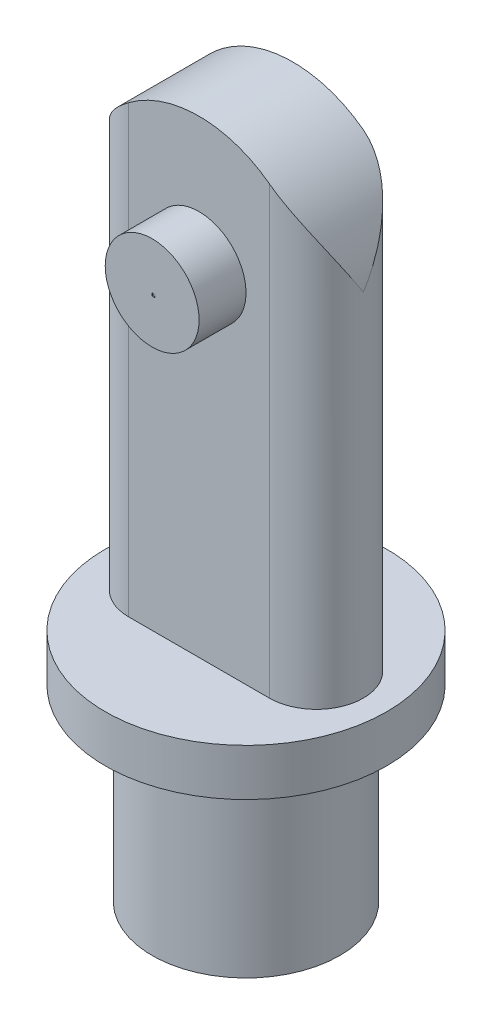
from build123d import *

# Parameters (mm, degrees)
BOSS_EXTRUDE1_DEPTH = 500
CUT_EXTRUDE1_DEPTH  = 100
SKETCH9_R           = 50
BOSS_EXTRUDE2_DEPTH = 50
SKETCH10_W          = 3.090432628
SKETCH10_H          = 2.993135046
CUT_EXTRUDE2_DEPTH  = 1


with BuildPart() as part:
    # Sketch4 → Revolve1 (revolve)
    with BuildSketch(Plane.XY):
        Polygon((0, 101.851851852), (0, -148.148148148), (100, -148.148148148), (100, 51.851851852), (150, 51.851851852), (150, 101.851851852), align=None)
    revolve(axis=Axis((0, 101.851851852, 0), (0, -1, 0)))

    # Sketch7 → Boss-Extrude1 (add)
    with BuildSketch(Plane(origin=(0, 101.851851852, 0), x_dir=(1, 0, 0), z_dir=(0, 1, 0))):
        with BuildLine():
            Line((-75, 50), (75, 50))
            ThreePointArc((75, 50), (125, 0), (75, -50))
            Line((75, -50), (-75, -50))
            ThreePointArc((-75, -50), (-125, 0), (-75, 50))
        make_face()
    extrude(amount=BOSS_EXTRUDE1_DEPTH)

    # Sketch8 → Cut-Extrude1 (cut)
    with BuildSketch(Plane.XY.offset(50)):
        with BuildLine():
            Line((-125, 476.351851852), (-125, 601.851851852))
            Line((-125, 601.851851852), (125, 2101.851851852))
            Line((125, 2101.851851852), (125, 476.351851852))
            ThreePointArc((125, 476.351851852), (0, 601.351851852), (-125, 476.351851852))
        make_face()
    extrude(amount=-CUT_EXTRUDE1_DEPTH, mode=Mode.SUBTRACT)

    # Sketch9 → Boss-Extrude2 (add)
    with BuildSketch(Plane.XY.offset(50)):
        with Locations((0, 463.3)):
            Circle(SKETCH9_R)
    extrude(amount=BOSS_EXTRUDE2_DEPTH)

    # Sketch10 → Cut-Extrude2 (cut)
    with BuildSketch(Plane.XY.offset(100)):
        with Locations((1.545216314, 461.803432477)):
            Rectangle(SKETCH10_W, SKETCH10_H)
    extrude(amount=-CUT_EXTRUDE2_DEPTH, mode=Mode.SUBTRACT)


solid = part.part
